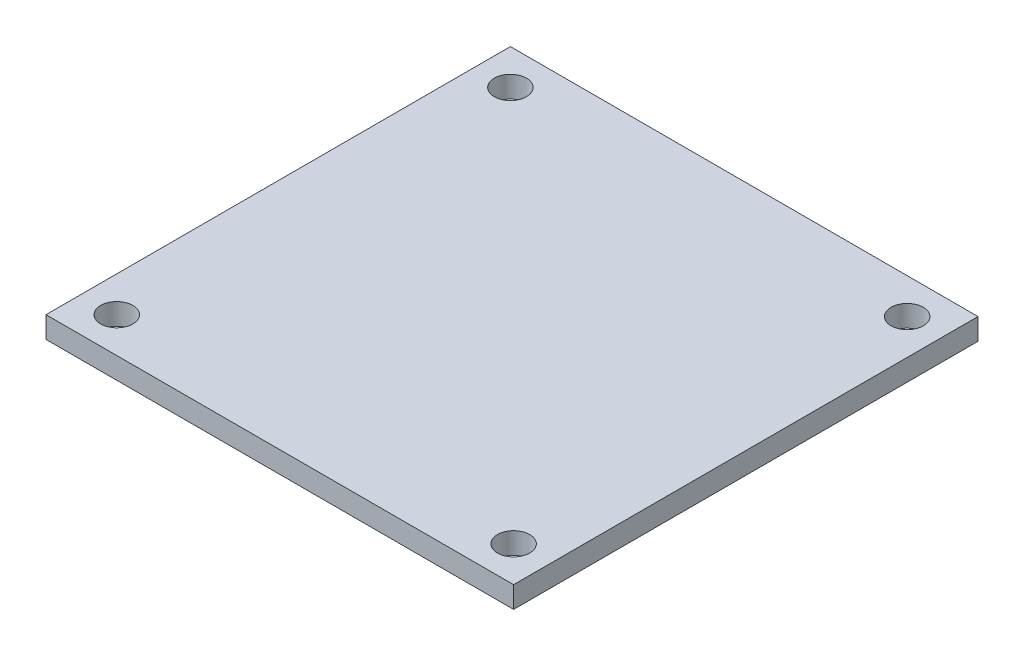
from build123d import *

# Parameters (mm, degrees)
ESQUISSE1_W        = 43.6
ESQUISSE1_H        = 43.3
ESQUISSE1_R        = 1.5
BOSS_EXTRU_1_DEPTH = 2


with BuildPart() as part:
    # Esquisse1 → Boss.-Extru.1 (new body)
    with BuildSketch(Plane(origin=(0, 0, 0), x_dir=(1, 0, 0), z_dir=(0, 1, 0))):
        with Locations((21.8, 21.65)):
            Rectangle(ESQUISSE1_W, ESQUISSE1_H)
        with Locations(Location((3.3, 40, 0), (0, 0, 270))):
            Circle(ESQUISSE1_R, mode=Mode.SUBTRACT)
        with Locations(Location((40.3, 40, 0), (0, 0, 90))):
            Circle(ESQUISSE1_R, mode=Mode.SUBTRACT)
        with Locations(Location((40.3, 3.3, 0), (0, 0, 270))):
            Circle(ESQUISSE1_R, mode=Mode.SUBTRACT)
        with Locations(Location((3.3, 3.3, 0), (0, 0, 90))):
            Circle(ESQUISSE1_R, mode=Mode.SUBTRACT)
    extrude(amount=BOSS_EXTRU_1_DEPTH)


solid = part.part
